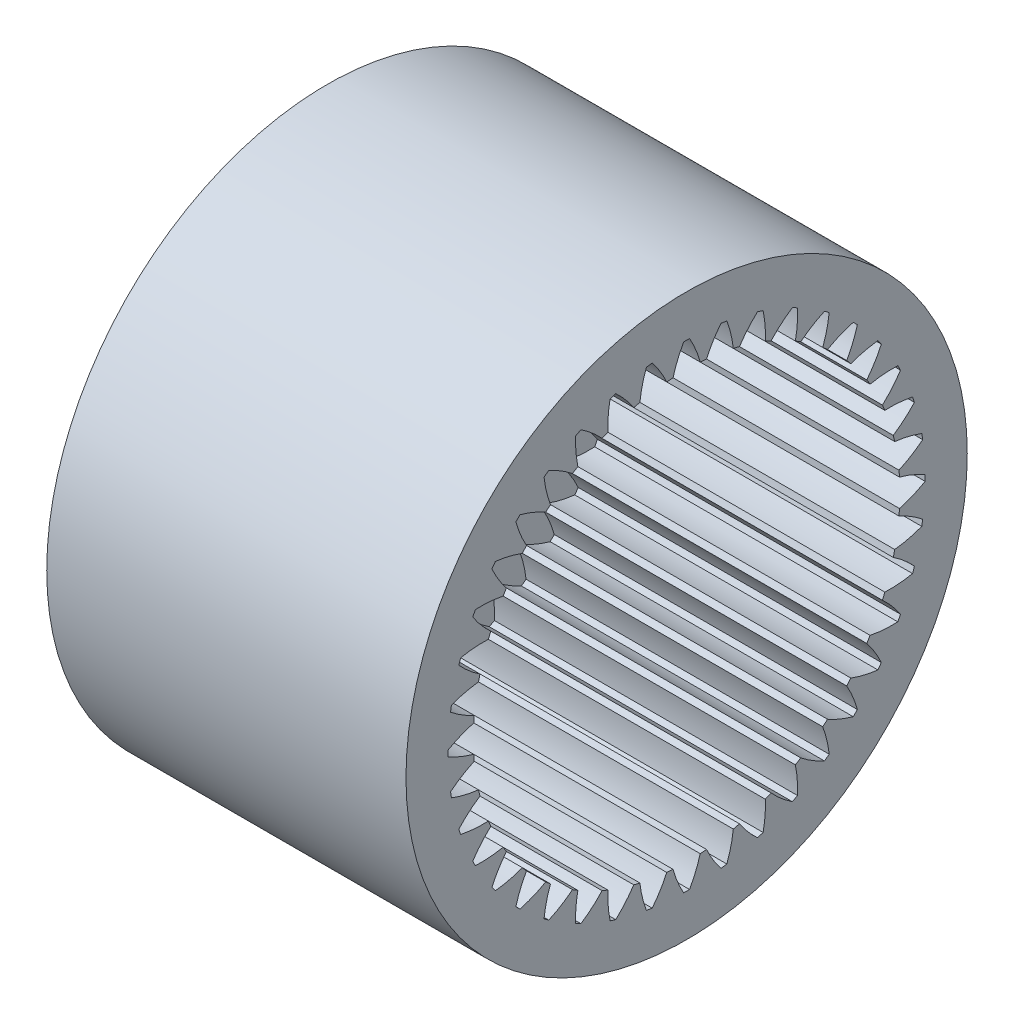
from build123d import *

# Parameters (mm, degrees)
BASPROSKE_W         = 54
BASPROSKE_H         = 12
TOOTHCUT_DEPTH      = 89.971905678
TEETHCUTS_COUNT     = 40
TEETHCUTS_ANGLE     = 351
SKETCH2_R           = 50
SKETCH2_R_2         = 11
BOSS_EXTRUDE1_DEPTH = 10


with BuildPart() as part:
    # BasProSke → Base-Revolve (revolve)
    with BuildSketch(Plane(origin=(0, 0, 0), x_dir=(1, 0, 0), z_dir=(0, 1, 0)), mode=Mode.PRIVATE) as base_revolve_sk:
        with Locations((27, 44)):
            Rectangle(BASPROSKE_W, BASPROSKE_H)
    revolve(base_revolve_sk.sketch.rotate(Axis((-10, 0, 0), (1, 0, 0)), 180), axis=Axis((-10, 0, 0), (1, 0, 0)))

    # TooCutSke → ToothCut (cut, through all)
    with BuildSketch(Plane(origin=(0, 0, 0), x_dir=(0, 0, -1), z_dir=(1, 0, 0))):
        with BuildLine():
            ThreePointArc((2.427265626, 37.896947459), (1.618641911, 40.256878641), (0.522524415, 42.497787816))
            ThreePointArc((0.522524415, 42.497787816), (0, 42.501), (-0.522524415, 42.497787816))
            ThreePointArc((-0.522524415, 42.497787816), (-1.618641911, 40.256878641), (-2.427265626, 37.896947459))
            ThreePointArc((-2.427265626, 37.896947459), (0, 37.9746), (2.427265626, 37.896947459))
        make_face()
    toothcut = extrude(amount=TOOTHCUT_DEPTH, mode=Mode.SUBTRACT)

    # TeethCuts: ToothCut ×40 about axis
    teethcuts_axis = Axis((-10, 0, 0), (1, 0, 0))
    for i in range(1, TEETHCUTS_COUNT):
        add(toothcut.rotate(teethcuts_axis, i * TEETHCUTS_ANGLE / (TEETHCUTS_COUNT - 1)), mode=Mode.SUBTRACT)

    # Sketch2 → Boss-Extrude1 (add)
    with BuildSketch(Plane.ZY):
        Circle(SKETCH2_R)
        Circle(SKETCH2_R_2, mode=Mode.SUBTRACT)
    extrude(amount=BOSS_EXTRUDE1_DEPTH)


solid = part.part
